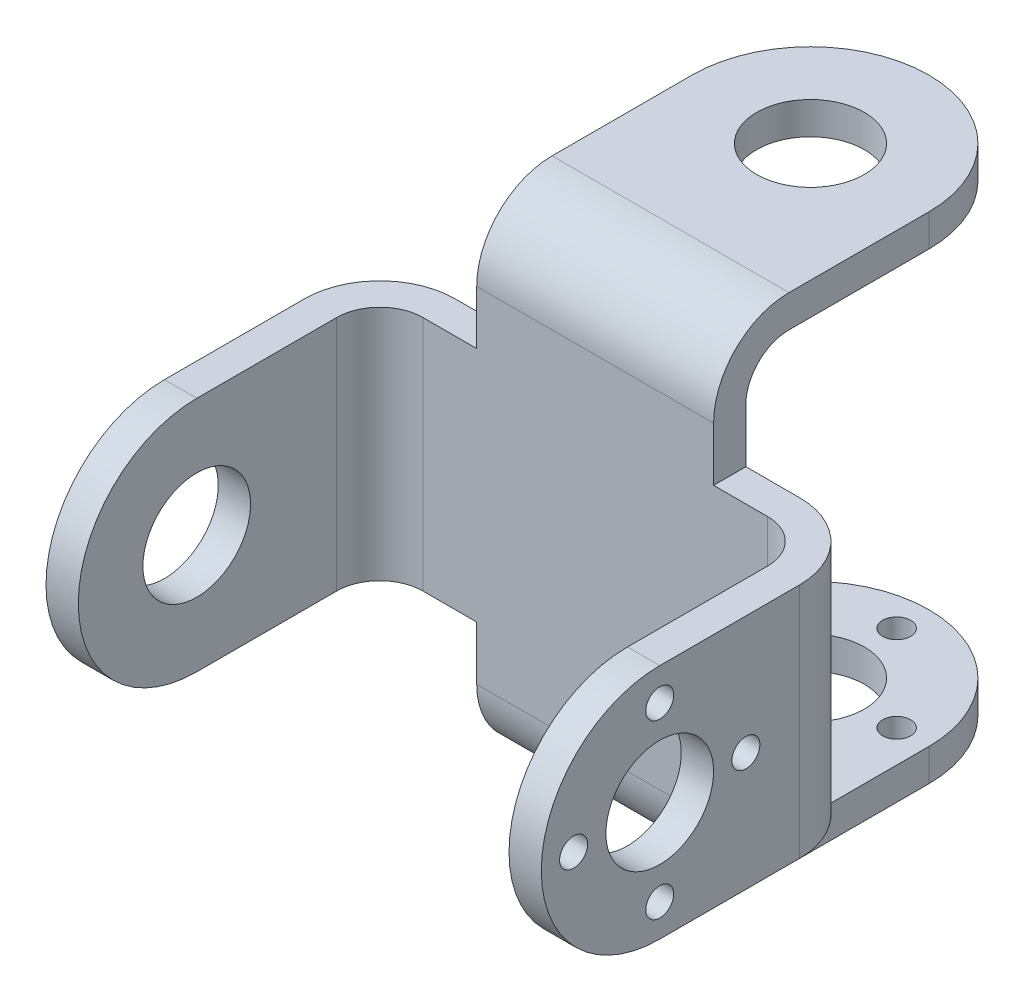
from build123d import *

# Parameters (mm, degrees)
BOSS_EXTRUDE1_DEPTH  = 3
BOSS_EXTRUDE2_DEPTH  = 22
BOSS_EXTRUDE10_DEPTH = 22
BOSS_EXTRUDE3_START  = 3
SKETCH3_R            = 1.3
SKETCH3_R_2          = 5
BOSS_EXTRUDE3_DEPTH  = 3
SKETCH5_W            = 32
SKETCH5_H            = 22
BOSS_EXTRUDE4_DEPTH  = 3
BOSS_EXTRUDE5_DEPTH  = 22
SKETCH8_R            = 1.3
BOSS_EXTRUDE8_DEPTH  = 3
BOSS_EXTRUDE9_START  = -3
BOSS_EXTRUDE9_DEPTH  = 3


with BuildPart() as part:
    # Sketch1 → Boss-Extrude1 (new body)
    with BuildSketch(Plane(origin=(0, 0, 0), x_dir=(1, 0, 0), z_dir=(0, 1, 0))):
        with BuildLine():
            ThreePointArc((-5, 0), (0, 5), (5, 0))
            Line((5, 0), (11, 0))
            ThreePointArc((11, 0), (0, 11), (-11, 0))
            Line((-11, 0), (-5, 0))
        make_face()
        with BuildLine():
            Line((11, 0), (5, 0))
            ThreePointArc((5, 0), (0, -5), (-5, 0))
            Line((-5, 0), (-11, 0))
            ThreePointArc((-11, 0), (0, -11), (11, 0))
        make_face()
        with BuildLine():
            Line((11, -13), (11, 0))
            ThreePointArc((11, 0), (0, -11), (-11, 0))
            Line((-11, 0), (-11, -13))
            Line((-11, -13), (11, -13))
        make_face()
    extrude(amount=BOSS_EXTRUDE1_DEPTH)

    # Sketch2 → Boss-Extrude2 (add)
    with BuildSketch(Plane(origin=(11, 0, 0), x_dir=(0, 0, -1), z_dir=(1, 0, 0))):
        with BuildLine():
            Line((-13, 0), (-13, 3))
            ThreePointArc((-13, 3), (-17.949747468, 0.949747468), (-20, -4))
            Line((-20, -4), (-20, -36))
            Line((-20, -36), (-17, -36))
            Line((-17, -36), (-17, -4))
            ThreePointArc((-17, -4), (-15.828427125, -1.171572875), (-13, 0))
        make_face()
    extrude(amount=-BOSS_EXTRUDE2_DEPTH)

    # Sketch2<4> → Boss-Extrude10 (add)
    with BuildSketch(Plane(origin=(11, 0, 0), x_dir=(0, 0, -1), z_dir=(1, 0, 0))):
        with BuildLine():
            Line((-20, -36), (-17, -36))
            ThreePointArc((-17, -36), (-15.828427125, -38.828427125), (-13, -40))
            Line((-13, -40), (-13, -43))
            ThreePointArc((-13, -43), (-17.949747468, -40.949747468), (-20, -36))
        make_face()
    extrude(amount=-BOSS_EXTRUDE10_DEPTH)

    # Sketch3 → Boss-Extrude3 (add)
    with BuildSketch(Plane(origin=(0, -40, 0), x_dir=(-1, 0, 0), z_dir=(0, -1, 0)).offset(BOSS_EXTRUDE3_START)):
        with BuildLine():
            ThreePointArc((11, 0), (0, 11), (-11, 0))
            Line((-11, 0), (-11, -13))
            Line((-11, -13), (11, -13))
            Line((11, -13), (11, 0))
        make_face()
        with Locations(Location((8, 0, 0), (0, 0, 90))):
            Circle(SKETCH3_R, mode=Mode.SUBTRACT)
        with Locations(Location((0, 0, 0), (0, 0, 270))):
            Circle(SKETCH3_R_2, mode=Mode.SUBTRACT)
        with Locations(Location((-8, 0, 0), (0, 0, 90))):
            Circle(SKETCH3_R, mode=Mode.SUBTRACT)
        with Locations(Location((0, 8, 0), (0, 0, 90))):
            Circle(SKETCH3_R, mode=Mode.SUBTRACT)
        with Locations(Location((0, -8, 0), (0, 0, 90))):
            Circle(SKETCH3_R, mode=Mode.SUBTRACT)
    extrude(amount=-BOSS_EXTRUDE3_DEPTH)

    # Sketch5 → Boss-Extrude4 (add)
    with BuildSketch(Plane.XY.offset(20)):
        with Locations((0, -20)):
            Rectangle(SKETCH5_W, SKETCH5_H)
    extrude(amount=-BOSS_EXTRUDE4_DEPTH)

    # Sketch6 → Boss-Extrude5 (add)
    with BuildSketch(Plane(origin=(0, -9, 0), x_dir=(1, 0, 0), z_dir=(0, 1, 0))):
        with BuildLine():
            Line((-23, -24), (-20, -24))
            ThreePointArc((-20, -24), (-18.828427125, -21.171572875), (-16, -20))
            Line((-16, -20), (-16, -17))
            ThreePointArc((-16, -17), (-20.949747468, -19.050252532), (-23, -24))
        make_face()
        with BuildLine():
            Line((20, -24), (23, -24))
            ThreePointArc((23, -24), (20.949747468, -19.050252532), (16, -17))
            Line((16, -17), (16, -20))
            ThreePointArc((16, -20), (18.828427125, -21.171572875), (20, -24))
        make_face()
    extrude(amount=-BOSS_EXTRUDE5_DEPTH)

    # Sketch8 → Boss-Extrude8 (add)
    # profile 1 of 3: a face of its own
    with BuildSketch(Plane.ZY.offset(-23)):
        with BuildLine():
            Line((37, -9), (24, -9))
            Line((24, -9), (24, -31))
            Line((24, -31), (37, -31))
            ThreePointArc((37, -31), (26, -20), (37, -9))
        make_face()
    # profile 2 of 3: a face of its own
    with BuildSketch(Plane.ZY.offset(-23)):
        with BuildLine():
            Line((37, -10.7), (37, -9))
            ThreePointArc((37, -9), (26, -20), (37, -31))
            Line((37, -31), (37, -29.3))
            ThreePointArc((37, -29.3), (35.7, -28), (37, -26.7))
            Line((37, -26.7), (37, -25))
            ThreePointArc((37, -25), (32, -20), (37, -15))
            Line((37, -15), (37, -13.3))
            ThreePointArc((37, -13.3), (35.7, -12), (37, -10.7))
        make_face()
        with Locations((29, -20)):
            Circle(SKETCH8_R, mode=Mode.SUBTRACT)
    # profile 3 of 3: a face of its own
    with BuildSketch(Plane.ZY.offset(-23)):
        with BuildLine():
            ThreePointArc((48, -20), (44.778174593, -12.221825407), (37, -9))
            Line((37, -9), (37, -10.7))
            ThreePointArc((37, -10.7), (37.919238816, -11.080761184), (38.3, -12))
            ThreePointArc((38.3, -12), (37.919238816, -12.919238816), (37, -13.3))
            Line((37, -13.3), (37, -15))
            ThreePointArc((37, -15), (40.535533906, -16.464466094), (42, -20))
            ThreePointArc((42, -20), (40.535533906, -23.535533906), (37, -25))
            Line((37, -25), (37, -26.7))
            ThreePointArc((37, -26.7), (37.919238816, -27.080761184), (38.3, -28))
            ThreePointArc((38.3, -28), (37.919238816, -28.919238816), (37, -29.3))
            Line((37, -29.3), (37, -31))
            ThreePointArc((37, -31), (44.778174593, -27.778174593), (48, -20))
        make_face()
        with Locations((45, -20)):
            Circle(SKETCH8_R, mode=Mode.SUBTRACT)
    extrude(amount=BOSS_EXTRUDE8_DEPTH)

    # Sketch9 → Boss-Extrude9 (add)
    with BuildSketch(Plane.ZY.offset(23).offset(BOSS_EXTRUDE9_START)):
        with BuildLine():
            Line((24, -9), (24, -31))
            Line((24, -31), (37, -31))
            ThreePointArc((37, -31), (26, -20), (37, -9))
            Line((37, -9), (24, -9))
        make_face()
        with BuildLine():
            ThreePointArc((37, -9), (26, -20), (37, -31))
            Line((37, -31), (37, -25))
            ThreePointArc((37, -25), (32, -20), (37, -15))
            Line((37, -15), (37, -9))
        make_face()
        with BuildLine():
            Line((37, -25), (37, -31))
            ThreePointArc((37, -31), (44.778174593, -27.778174593), (48, -20))
            ThreePointArc((48, -20), (44.778174593, -12.221825407), (37, -9))
            Line((37, -9), (37, -15))
            ThreePointArc((37, -15), (40.535533906, -16.464466094), (42, -20))
            ThreePointArc((42, -20), (40.535533906, -23.535533906), (37, -25))
        make_face()
    extrude(amount=BOSS_EXTRUDE9_DEPTH)


solid = part.part
